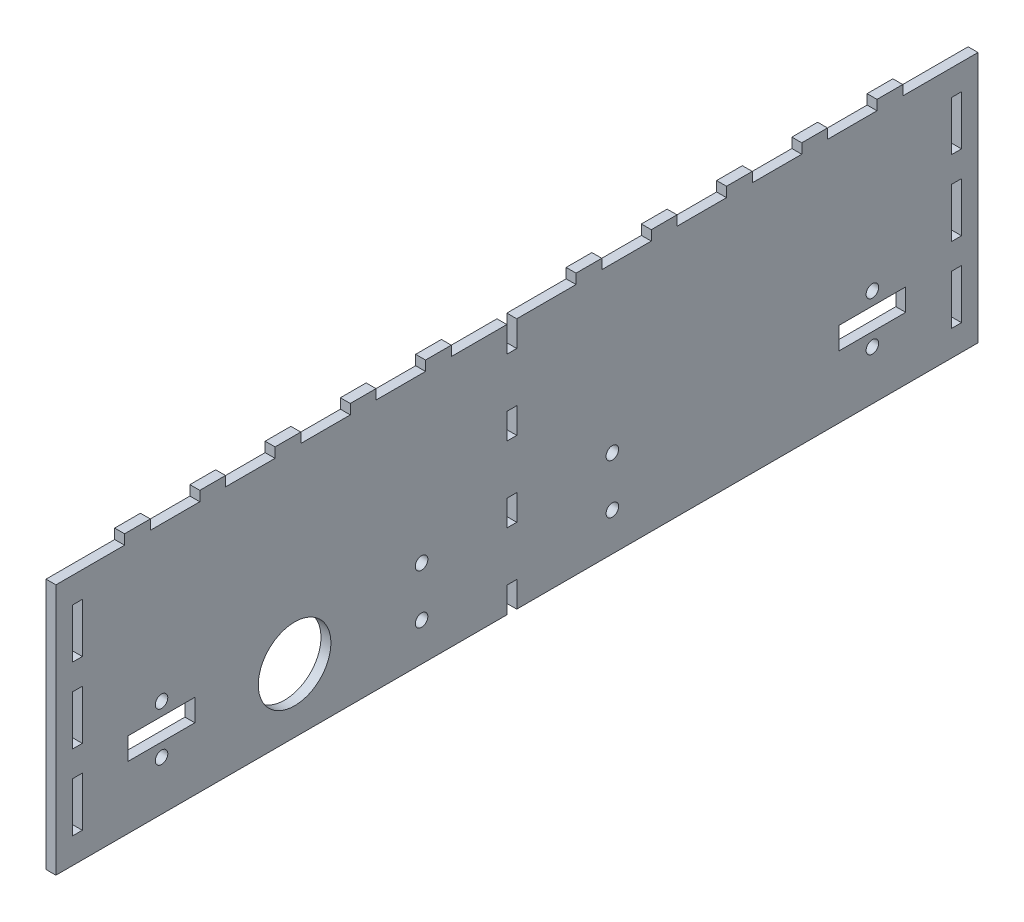
from build123d import *

# Parameters (mm, degrees)
SKETCH1_W               = 279.4
SKETCH1_H               = 76.2
BOSS_EXTRUDE1_DEPTH     = 3
SKETCH3_W               = 3
SKETCH3_H               = 15
CUT_EXTRUDE1_DEPTH      = 145.833352512
LPATTERN1_COUNT         = 3
LPATTERN1_PITCH         = 22.8
MIRROR1_COPY_1_SKETCH_W = 3
MIRROR1_COPY_1_SKETCH_H = 15
MIRROR1_COPY_1_DEPTH    = 145.833352512
MIRROR1_COPY_2_SKETCH_W = 3
MIRROR1_COPY_2_SKETCH_H = 15
MIRROR1_COPY_2_DEPTH    = 145.833352512
SKETCH6_W               = 3
SKETCH6_H               = 7.8
CUT_EXTRUDE2_DEPTH      = 145.833352512
LPATTERN2_COUNT         = 4
LPATTERN2_PITCH         = 22.8
SKETCH8_W               = 3
SKETCH8_H               = 7.8
BOSS_EXTRUDE2_DEPTH     = 3
LPATTERN4_COUNT         = 11
LPATTERN4_PITCH         = 22.8
SKETCH9_R               = 11
CUT_EXTRUDE3_DEPTH      = 146.651295909
F_6_CLEARANCE_HOLE1_D   = 3.7973
CUT_EXTRUDE4_REACH      = 147.651
SKETCH12_W              = 20.2
SKETCH12_H              = 6.7
F_6_CLEARANCE_HOLE2_D   = 3.7973


with BuildPart() as part:
    # Sketch1 → Boss-Extrude1 (new body)
    with BuildSketch(Plane(origin=(0, 0, 0), x_dir=(0, 0, -1), z_dir=(1, 0, 0))):
        Rectangle(SKETCH1_W, SKETCH1_H)
    extrude(amount=-BOSS_EXTRUDE1_DEPTH)

    # Sketch3 → Cut-Extrude1 (cut, through all)
    with BuildSketch(Plane.ZY.offset(3)):
        with Locations((133.2, 22.8)):
            Rectangle(SKETCH3_W, SKETCH3_H)
    cut_extrude1 = extrude(amount=-CUT_EXTRUDE1_DEPTH, mode=Mode.SUBTRACT)

    # LPattern1: Cut-Extrude1 ×3
    with Locations(*[(0, -i * LPATTERN1_PITCH, 0) for i in range(1, LPATTERN1_COUNT)]):
        add(cut_extrude1, mode=Mode.SUBTRACT)

    # Mirror1: Cut-Extrude1 across plane
    add(cut_extrude1.mirror(Plane.XY), mode=Mode.SUBTRACT)

    # Mirror1 copy 1 sketch → Mirror1 copy 1 (cut, through all)
    with BuildSketch(Plane(origin=(-3, -22.8, 0), x_dir=(0, 0, -1), z_dir=(-1, 0, 0))):
        with Locations((133.2, -22.8)):
            Rectangle(MIRROR1_COPY_1_SKETCH_W, MIRROR1_COPY_1_SKETCH_H)
    extrude(amount=-MIRROR1_COPY_1_DEPTH, mode=Mode.SUBTRACT)

    # Mirror1 copy 2 sketch → Mirror1 copy 2 (cut, through all)
    with BuildSketch(Plane(origin=(-3, -45.6, 0), x_dir=(0, 0, -1), z_dir=(-1, 0, 0))):
        with Locations((133.2, -22.8)):
            Rectangle(MIRROR1_COPY_2_SKETCH_W, MIRROR1_COPY_2_SKETCH_H)
    extrude(amount=-MIRROR1_COPY_2_DEPTH, mode=Mode.SUBTRACT)

    # Sketch6 → Cut-Extrude2 (cut, through all)
    with BuildSketch(Plane.ZY.offset(3)):
        with Locations((1.56, 34.2)):
            Rectangle(SKETCH6_W, SKETCH6_H)
    cut_extrude2 = extrude(amount=-CUT_EXTRUDE2_DEPTH, mode=Mode.SUBTRACT)

    # LPattern2: Cut-Extrude2 ×4
    with Locations(*[(0, -i * LPATTERN2_PITCH, 0) for i in range(1, LPATTERN2_COUNT)]):
        add(cut_extrude2, mode=Mode.SUBTRACT)

    # Sketch8 → Boss-Extrude2 (add)
    with BuildSketch(Plane(origin=(0, 38.1, 0), x_dir=(1, 0, 0), z_dir=(0, 1, 0))):
        with Locations((-1.5, 113)):
            Rectangle(SKETCH8_W, SKETCH8_H)
    boss_extrude2 = extrude(amount=BOSS_EXTRUDE2_DEPTH)

    # LPattern4: Boss-Extrude2 ×11, 1 skipped
    with Locations(*[(0, 0, i * LPATTERN4_PITCH) for i in range(1, LPATTERN4_COUNT) if i not in (5,)]):
        add(boss_extrude2)

    # Sketch9 → Cut-Extrude3 (cut, through all)
    with BuildSketch(Plane.ZY.offset(3)):
        with Locations((67.38, -18.8)):
            Circle(SKETCH9_R)
    extrude(amount=-CUT_EXTRUDE3_DEPTH, mode=Mode.SUBTRACT)

    # #6 Clearance Hole1 (through all)
    with Locations(Plane(origin=(0, 0, 0), x_dir=(0, 0, -1), z_dir=(1, 0, 0))):
        with Locations((28.9, -26.55), (28.9, -11.55), (-28.9, -11.55), (-28.9, -26.55)):
            Hole(F_6_CLEARANCE_HOLE1_D / 2)

    # Sketch12 → Cut-Extrude4 (cut, up to next)
    with BuildSketch(Plane.ZY.offset(3), mode=Mode.PRIVATE) as cut_extrude4_sk1:
        with Locations((-107.7, -15.8)):
            Rectangle(SKETCH12_W, SKETCH12_H)
    cut_extrude4_tool1 = extrude(cut_extrude4_sk1.sketch, amount=-CUT_EXTRUDE4_REACH, mode=Mode.PRIVATE) & part.part
    # Sketch12 → Cut-Extrude4 (cut, up to next)
    with BuildSketch(Plane.ZY.offset(3), mode=Mode.PRIVATE) as cut_extrude4_sk2:
        with Locations((107.7, -15.8)):
            Rectangle(SKETCH12_W, SKETCH12_H)
    cut_extrude4_tool2 = extrude(cut_extrude4_sk2.sketch, amount=-CUT_EXTRUDE4_REACH, mode=Mode.PRIVATE) & part.part
    add(cut_extrude4_tool1.solids().sort_by_distance((-3, -15.8, -107.7))[0], mode=Mode.SUBTRACT)
    add(cut_extrude4_tool2.solids().sort_by_distance((-3, -15.8, 107.7))[0], mode=Mode.SUBTRACT)

    # #6 Clearance Hole2 (through all)
    with Locations(Plane.ZY.offset(3)):
        with Locations((-107.7, -23.15), (-107.7, -8.45), (107.7, -23.15), (107.7, -8.45)):
            Hole(F_6_CLEARANCE_HOLE2_D / 2)


solid = part.part
